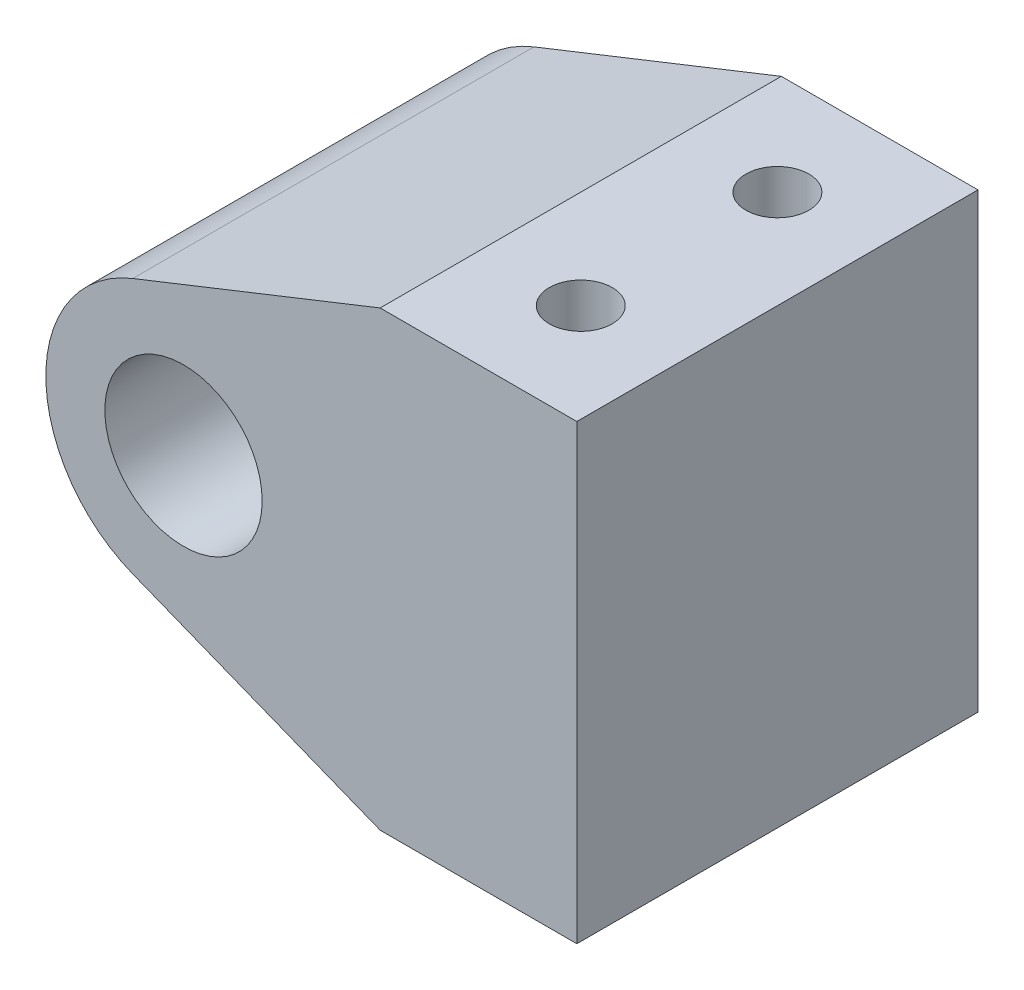
from build123d import *

# Parameters (mm, degrees)
SKETCH1_R           = 4
BOSS_EXTRUDE1_DEPTH = 20.4
SKETCH2_R           = 1.6
CUT_EXTRUDE1_DEPTH  = 41.916500339


with BuildPart() as part:
    # Sketch1 → Boss-Extrude1 (new body)
    with BuildSketch(Plane.XY):
        with BuildLine():
            Line((0, 0), (-10, 0))
            Line((-10, 0), (-22.582249313, 4.99369625))
            ThreePointArc((-22.582249313, 4.99369625), (-27, 11.5), (-22.582249313, 18.00630375))
            Line((-22.582249313, 18.00630375), (-10, 23))
            Line((-10, 23), (0, 23))
            Line((0, 23), (0, 0))
        make_face()
        with Locations((-20, 11.5)):
            Circle(SKETCH1_R, mode=Mode.SUBTRACT)
    extrude(amount=BOSS_EXTRUDE1_DEPTH)

    # Sketch2 → Cut-Extrude1 (cut, through all)
    with BuildSketch(Plane(origin=(0, 23, 0), x_dir=(1, 0, 0), z_dir=(0, 1, 0))):
        with Locations(Location((-5, -5.2, 0), (0, 0, 180))):
            Circle(SKETCH2_R)
        with Locations(Location((-5, -15.2, 0), (0, 0, 180))):
            Circle(SKETCH2_R)
    extrude(amount=-CUT_EXTRUDE1_DEPTH, mode=Mode.SUBTRACT)


solid = part.part
